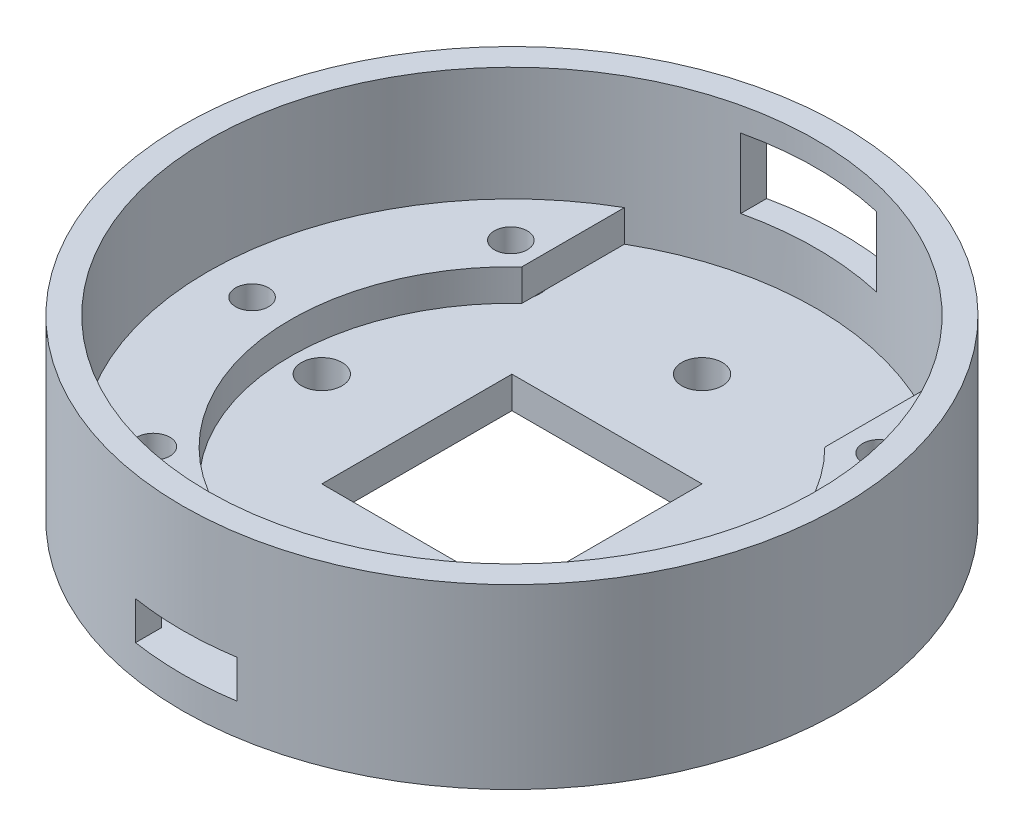
from build123d import *
from build123d.topology import SkipClean

# Parameters (mm, degrees)
SKETCH_1_R          = 24
SKETCH_1_R_2        = 1.6
SKETCH_1_W          = 15
SKETCH_1_H          = 15
SKETCH_1_R_3        = 1.3
EXTRUDE_1_DEPTH     = 2.5
SKETCH_1_4_R        = 26
SKETCH_1_4_R_2      = 24
EXTRUDE_2_DEPTH     = 14
SKETCH_1_6_R        = 1.3
EXTRUDE_4_DEPTH     = 5
CUT_EXTRUDE_1_DEPTH = 12.1
EXTRUDE_5_DEPTH     = 6.6
SKETCH_1_11_R       = 1.3
SKETCH_1_11_R_2     = 2.3
CUT_EXTRUDE_2_DEPTH = 2.5
CUT_EXTRUDE_5_DEPTH = 5.5
EXTRUDE_6_DEPTH     = 2.5


with BuildPart() as part:
    # 草图1 → 凸台-拉伸1 (new body)
    with BuildSketch(Plane(origin=(0, 0, 0), x_dir=(1, 0, 0), z_dir=(0, 1, 0))):
        Circle(SKETCH_1_R)
        with BuildLine():
            Line((-11.939965885, 13.609247836), (-11.939965885, 14.590752164))
            ThreePointArc((-11.939965885, 14.590752164), (-11.887, 14.1), (-11.939965885, 13.609247836))
        make_face(mode=Mode.SUBTRACT)
        with Locations((0, -15)):
            Circle(SKETCH_1_R_2, mode=Mode.SUBTRACT)
        with Locations((-15, 0)):
            Circle(SKETCH_1_R_2, mode=Mode.SUBTRACT)
        Rectangle(SKETCH_1_W, SKETCH_1_H, mode=Mode.SUBTRACT)
        with Locations((15, 0)):
            Circle(SKETCH_1_R_2, mode=Mode.SUBTRACT)
        with Locations((0, 15)):
            Circle(SKETCH_1_R_2, mode=Mode.SUBTRACT)
        with Locations((20.498, 0)):
            Circle(SKETCH_1_R_3, mode=Mode.SUBTRACT)
        with Locations((14.872, 14.097)):
            Circle(SKETCH_1_R_3, mode=Mode.SUBTRACT)
        with Locations((14.872, -14.097)):
            Circle(SKETCH_1_R_3, mode=Mode.SUBTRACT)
        with Locations((-14.187, -14.1)):
            Circle(SKETCH_1_R_3, mode=Mode.SUBTRACT)
        with Locations((-20.498, 0)):
            Circle(SKETCH_1_R_3, mode=Mode.SUBTRACT)
        with Locations((-14.187, 14.1)):
            Circle(SKETCH_1_R_3, mode=Mode.SUBTRACT)
    extrude(amount=EXTRUDE_1_DEPTH)

    # 草图1<4> → 凸台-拉伸2 (add)
    with BuildSketch(Plane(origin=(0, 0, 0), x_dir=(1, 0, 0), z_dir=(0, 1, 0))):
        Circle(SKETCH_1_4_R)
        Circle(SKETCH_1_4_R_2, mode=Mode.SUBTRACT)
    extrude(amount=EXTRUDE_2_DEPTH)

    # 草图1<6> → 凸台-拉伸4 (add)
    # profile 1 of 2: a face of its own
    with BuildSketch(Plane(origin=(0, 0, 0), x_dir=(1, 0, 0), z_dir=(0, 1, 0))):
        with BuildLine():
            Line((12.327725044, 20.59192063), (12.327725044, 12.355677376))
            ThreePointArc((12.327725044, 12.355677376), (17.325666659, -2.111123633), (9, -14.954449778))
            Line((9, -14.954449778), (9, -22.248595461))
            ThreePointArc((9, -22.248595461), (23.927921319, -1.858650415), (12.327725044, 20.59192063))
        make_face()
        with Locations((14.872, -14.097)):
            Circle(SKETCH_1_6_R, mode=Mode.SUBTRACT)
        with Locations((20.498, 0)):
            Circle(SKETCH_1_6_R, mode=Mode.SUBTRACT)
        with Locations((14.872, 14.097)):
            Circle(SKETCH_1_6_R, mode=Mode.SUBTRACT)
    # profile 2 of 2: a face of its own
    with BuildSketch(Plane(origin=(0, 0, 0), x_dir=(1, 0, 0), z_dir=(0, 1, 0))):
        with BuildLine():
            Line((-9, -22.248595461), (-9, -14.954449778))
            ThreePointArc((-9, -14.954449778), (-17.356224893, -1.843102181), (-11.939965885, 12.73078092))
            Line((-11.939965885, 12.73078092), (-11.939965885, 20.819154994))
            ThreePointArc((-11.939965885, 20.819154994), (-23.944275415, -1.634525883), (-9, -22.248595461))
        make_face()
        with Locations((-14.187, 14.1)):
            Circle(SKETCH_1_6_R, mode=Mode.SUBTRACT)
        with Locations((-14.187, -14.1)):
            Circle(SKETCH_1_6_R, mode=Mode.SUBTRACT)
        with Locations((-20.498, 0)):
            Circle(SKETCH_1_6_R, mode=Mode.SUBTRACT)
    extrude(amount=EXTRUDE_4_DEPTH)

    # 草图1<8> → 切除-拉伸1 (cut)
    with BuildSketch(Plane(origin=(0, 0, 0), x_dir=(1, 0, 0), z_dir=(0, 1, 0))):
        with BuildLine():
            ThreePointArc((-5.3490301, 23.396321869), (0, 24), (5.3490301, 23.396321869))
            Line((5.3490301, 23.396321869), (5.3490301, 25.44381805))
            ThreePointArc((5.3490301, 25.44381805), (0, 26), (-5.3490301, 25.44381805))
            Line((-5.3490301, 25.44381805), (-5.3490301, 23.396321869))
        make_face()
    extrude(amount=CUT_EXTRUDE_1_DEPTH, mode=Mode.SUBTRACT)

    # 草图1<9> → 凸台-拉伸5 (add)
    with BuildSketch(Plane(origin=(0, 0, 0), x_dir=(1, 0, 0), z_dir=(0, 1, 0))):
        with BuildLine():
            ThreePointArc((-5.3490301, 23.396321869), (0, 24), (5.3490301, 23.396321869))
            Line((5.3490301, 23.396321869), (5.3490301, 25.44381805))
            ThreePointArc((5.3490301, 25.44381805), (0, 26), (-5.3490301, 25.44381805))
            Line((-5.3490301, 25.44381805), (-5.3490301, 23.396321869))
        make_face()
    extrude(amount=EXTRUDE_5_DEPTH)

    # 草图1<11> → 切除-拉伸2 (cut)
    # profile 1 of 6: a face of its own
    with SkipClean():  # the faces are left unmerged after this step: merging them gives an invalid solid
        with BuildSketch(Plane(origin=(0, 0, 0), x_dir=(1, 0, 0), z_dir=(0, 1, 0))):
            with BuildLine():
                ThreePointArc((-11.939965885, 14.590752164), (-16.487, 14.1), (-11.939965885, 13.609247836))
                Line((-11.939965885, 13.609247836), (-11.939965885, 14.590752164))
            make_face()
            with Locations((-14.187, 14.1)):
                Circle(SKETCH_1_11_R, mode=Mode.SUBTRACT)
        # profile 2 of 6: a face of its own
        with BuildSketch(Plane(origin=(0, 0, 0), x_dir=(1, 0, 0), z_dir=(0, 1, 0))):
            with Locations((-20.498, 0)):
                Circle(SKETCH_1_11_R_2)
            with Locations((-20.498, 0)):
                Circle(SKETCH_1_11_R, mode=Mode.SUBTRACT)
        # profile 3 of 6: a face of its own
        with BuildSketch(Plane(origin=(0, 0, 0), x_dir=(1, 0, 0), z_dir=(0, 1, 0))):
            with Locations((-14.187, -14.1)):
                Circle(SKETCH_1_11_R_2)
            with Locations((-14.187, -14.1)):
                Circle(SKETCH_1_11_R, mode=Mode.SUBTRACT)
        # profile 4 of 6: a face of its own
        with BuildSketch(Plane(origin=(0, 0, 0), x_dir=(1, 0, 0), z_dir=(0, 1, 0))):
            with Locations((14.872, -14.097)):
                Circle(SKETCH_1_11_R_2)
            with Locations((14.872, -14.097)):
                Circle(SKETCH_1_11_R, mode=Mode.SUBTRACT)
        # profile 5 of 6: a face of its own
        with BuildSketch(Plane(origin=(0, 0, 0), x_dir=(1, 0, 0), z_dir=(0, 1, 0))):
            with Locations((20.498, 0)):
                Circle(SKETCH_1_11_R_2)
            with Locations((20.498, 0)):
                Circle(SKETCH_1_11_R, mode=Mode.SUBTRACT)
        # profile 6 of 6: a face of its own
        with BuildSketch(Plane(origin=(0, 0, 0), x_dir=(1, 0, 0), z_dir=(0, 1, 0))):
            with Locations((14.872, 14.097)):
                Circle(SKETCH_1_11_R_2)
            with Locations((14.872, 14.097)):
                Circle(SKETCH_1_11_R, mode=Mode.SUBTRACT)
        extrude(amount=CUT_EXTRUDE_2_DEPTH, mode=Mode.SUBTRACT)

    # 草图1<12> → 切除-拉伸5 (cut)
    with SkipClean():  # the faces are left unmerged after this step: merging them gives an invalid solid
        with BuildSketch(Plane(origin=(0, 0, 0), x_dir=(1, 0, 0), z_dir=(0, 1, 0))):
            with BuildLine():
                Line((4, -25.690465157), (4, -23.664319132))
                ThreePointArc((4, -23.664319132), (0, -24), (-4, -23.664319132))
                Line((-4, -23.664319132), (-4, -25.690465157))
                ThreePointArc((-4, -25.690465157), (0, -26), (4, -25.690465157))
            make_face()
        extrude(amount=CUT_EXTRUDE_5_DEPTH, mode=Mode.SUBTRACT)

    # 草图1<13> → 凸台-拉伸6 (add)
    with SkipClean():  # the faces are left unmerged after this step: merging them gives an invalid solid
        with BuildSketch(Plane(origin=(0, 0, 0), x_dir=(1, 0, 0), z_dir=(0, 1, 0))):
            with BuildLine():
                Line((4, -25.690465157), (4, -23.664319132))
                ThreePointArc((4, -23.664319132), (0, -24), (-4, -23.664319132))
                Line((-4, -23.664319132), (-4, -25.690465157))
                ThreePointArc((-4, -25.690465157), (0, -26), (4, -25.690465157))
            make_face()
        extrude(amount=EXTRUDE_6_DEPTH)


solid = part.part
